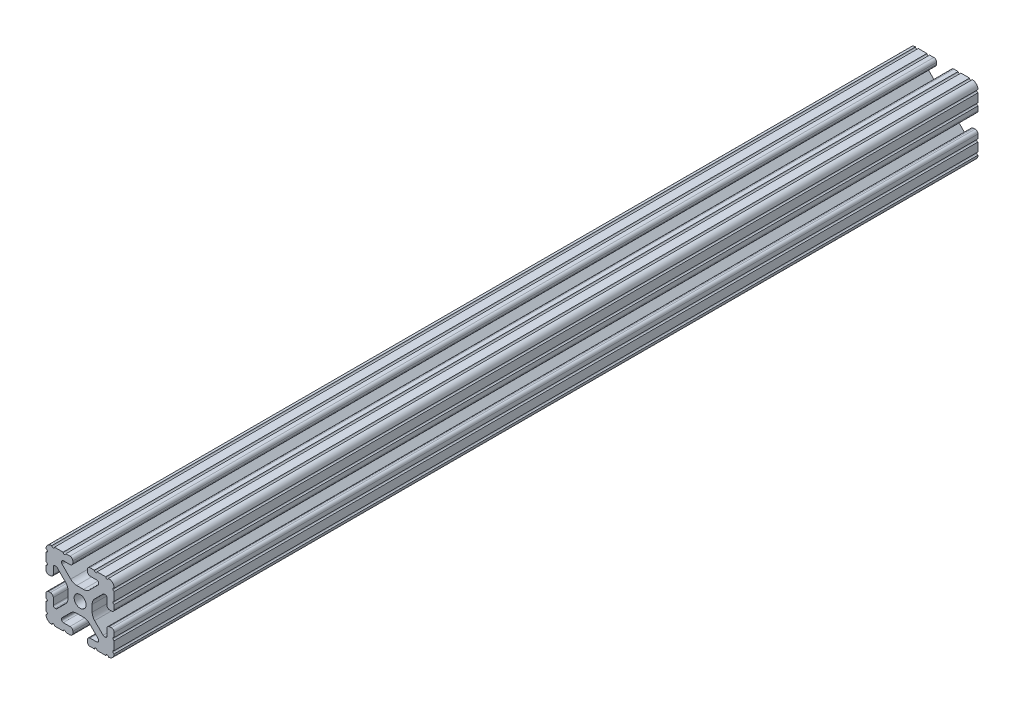
from build123d import *

# Parameters (mm, degrees)
SKETCH1_R           = 3.3274
BOSS_EXTRUDE1_DEPTH = 482.6


with BuildPart() as part:
    # Sketch1 → Boss-Extrude1 (new body)
    with BuildSketch(Plane.XY):
        with BuildLine():
            Line((-14.097, 10.287), (-13.528918, 10.287))
            ThreePointArc((-13.528918, 10.287), (-13.188712428, 10.219328904), (-12.900300071, 10.026617928))
            Line((-12.900300071, 10.026617928), (-8.129198975, 5.255516832))
            ThreePointArc((-8.129198975, 5.255516832), (-7.09957176, 3.71457081), (-6.738014764, 1.896901043))
            Line((-6.738014764, 1.896901043), (-6.738014764, -1.896901043))
            ThreePointArc((-6.738014764, -1.896901043), (-7.09957176, -3.71457081), (-8.129198975, -5.255516832))
            Line((-8.129198975, -5.255516832), (-12.900300071, -10.026617928))
            ThreePointArc((-12.900300071, -10.026617928), (-13.188712428, -10.219328904), (-13.528918, -10.287))
            Line((-13.528918, -10.287), (-14.097, -10.287))
            ThreePointArc((-14.097, -10.287), (-14.725617928, -10.026617928), (-14.986, -9.398))
            Line((-14.986, -9.398), (-14.986, -5.6388))
            ThreePointArc((-14.986, -5.6388), (-15.447248241, -4.525248241), (-16.5608, -4.064))
            Line((-16.5608, -4.064), (-17.4752, -4.064))
            ThreePointArc((-17.4752, -4.064), (-18.588751759, -4.525248241), (-19.05, -5.6388))
            Line((-19.05, -5.6388), (-19.05, -7.9756))
            ThreePointArc((-19.05, -7.9756), (-18.288, -8.7376), (-19.05, -9.4996))
            Line((-19.05, -9.4996), (-19.05, -14.3256))
            ThreePointArc((-19.05, -14.3256), (-18.288, -15.0876), (-19.05, -15.8496))
            Line((-19.05, -15.8496), (-19.05, -15.875))
            ThreePointArc((-19.05, -15.875), (-18.12006403, -18.12006403), (-15.875, -19.05))
            Line((-15.875, -19.05), (-15.8496, -19.05))
            ThreePointArc((-15.8496, -19.05), (-15.0876, -18.288), (-14.3256, -19.05))
            Line((-14.3256, -19.05), (-9.4996, -19.05))
            ThreePointArc((-9.4996, -19.05), (-8.7376, -18.288), (-7.9756, -19.05))
            Line((-7.9756, -19.05), (-5.6388, -19.05))
            ThreePointArc((-5.6388, -19.05), (-4.525248241, -18.588751759), (-4.064, -17.4752))
            Line((-4.064, -17.4752), (-4.064, -16.5608))
            ThreePointArc((-4.064, -16.5608), (-4.525248241, -15.447248241), (-5.6388, -14.986))
            Line((-5.6388, -14.986), (-9.398, -14.986))
            ThreePointArc((-9.398, -14.986), (-10.026617928, -14.725617928), (-10.287, -14.097))
            Line((-10.287, -14.097), (-10.287, -13.528918))
            ThreePointArc((-10.287, -13.528918), (-10.219328904, -13.188712428), (-10.026617928, -12.900300071))
            Line((-10.026617928, -12.900300071), (-5.255516832, -8.129198975))
            ThreePointArc((-5.255516832, -8.129198975), (-3.71457081, -7.09957176), (-1.896901043, -6.738014764))
            Line((-1.896901043, -6.738014764), (1.896901043, -6.738014764))
            ThreePointArc((1.896901043, -6.738014764), (3.71457081, -7.09957176), (5.255516832, -8.129198975))
            Line((5.255516832, -8.129198975), (10.026617928, -12.900300071))
            ThreePointArc((10.026617928, -12.900300071), (10.219328904, -13.188712428), (10.287, -13.528918))
            Line((10.287, -13.528918), (10.287, -14.097))
            ThreePointArc((10.287, -14.097), (10.026617928, -14.725617928), (9.398, -14.986))
            Line((9.398, -14.986), (5.6388, -14.986))
            ThreePointArc((5.6388, -14.986), (4.525248241, -15.447248241), (4.064, -16.5608))
            Line((4.064, -16.5608), (4.064, -17.4752))
            ThreePointArc((4.064, -17.4752), (4.525248241, -18.588751759), (5.6388, -19.05))
            Line((5.6388, -19.05), (7.9756, -19.05))
            ThreePointArc((7.9756, -19.05), (8.7376, -18.288), (9.4996, -19.05))
            Line((9.4996, -19.05), (14.3256, -19.05))
            ThreePointArc((14.3256, -19.05), (15.0876, -18.288), (15.8496, -19.05))
            Line((15.8496, -19.05), (15.875, -19.05))
            ThreePointArc((15.875, -19.05), (18.12006403, -18.12006403), (19.05, -15.875))
            Line((19.05, -15.875), (19.05, -15.8496))
            ThreePointArc((19.05, -15.8496), (18.288, -15.0876), (19.05, -14.3256))
            Line((19.05, -14.3256), (19.05, -9.4996))
            ThreePointArc((19.05, -9.4996), (18.288, -8.7376), (19.05, -7.9756))
            Line((19.05, -7.9756), (19.05, -5.6388))
            ThreePointArc((19.05, -5.6388), (18.588751759, -4.525248241), (17.4752, -4.064))
            Line((17.4752, -4.064), (16.5608, -4.064))
            ThreePointArc((16.5608, -4.064), (15.447248241, -4.525248241), (14.986, -5.6388))
            Line((14.986, -5.6388), (14.986, -9.398))
            ThreePointArc((14.986, -9.398), (14.725617928, -10.026617928), (14.097, -10.287))
            Line((14.097, -10.287), (13.528918, -10.287))
            ThreePointArc((13.528918, -10.287), (13.188712428, -10.219328904), (12.900300071, -10.026617928))
            Line((12.900300071, -10.026617928), (8.129198975, -5.255516832))
            ThreePointArc((8.129198975, -5.255516832), (7.09957176, -3.71457081), (6.738014764, -1.896901043))
            Line((6.738014764, -1.896901043), (6.738014764, 1.896901043))
            ThreePointArc((6.738014764, 1.896901043), (7.09957176, 3.71457081), (8.129198975, 5.255516832))
            Line((8.129198975, 5.255516832), (12.900300071, 10.026617928))
            ThreePointArc((12.900300071, 10.026617928), (13.188712428, 10.219328904), (13.528918, 10.287))
            Line((13.528918, 10.287), (14.097, 10.287))
            ThreePointArc((14.097, 10.287), (14.725617928, 10.026617928), (14.986, 9.398))
            Line((14.986, 9.398), (14.986, 5.6388))
            ThreePointArc((14.986, 5.6388), (15.447248241, 4.525248241), (16.5608, 4.064))
            Line((16.5608, 4.064), (17.4752, 4.064))
            ThreePointArc((17.4752, 4.064), (18.588751759, 4.525248241), (19.05, 5.6388))
            Line((19.05, 5.6388), (19.05, 7.9756))
            ThreePointArc((19.05, 7.9756), (18.288, 8.7376), (19.05, 9.4996))
            Line((19.05, 9.4996), (19.05, 14.3256))
            ThreePointArc((19.05, 14.3256), (18.288, 15.0876), (19.05, 15.8496))
            Line((19.05, 15.8496), (19.05, 15.875))
            ThreePointArc((19.05, 15.875), (18.12006403, 18.12006403), (15.875, 19.05))
            Line((15.875, 19.05), (15.8496, 19.05))
            ThreePointArc((15.8496, 19.05), (15.0876, 18.288), (14.3256, 19.05))
            Line((14.3256, 19.05), (9.4996, 19.05))
            ThreePointArc((9.4996, 19.05), (8.7376, 18.288), (7.9756, 19.05))
            Line((7.9756, 19.05), (5.6388, 19.05))
            ThreePointArc((5.6388, 19.05), (4.525248241, 18.588751759), (4.064, 17.4752))
            Line((4.064, 17.4752), (4.064, 16.5608))
            ThreePointArc((4.064, 16.5608), (4.525248241, 15.447248241), (5.6388, 14.986))
            Line((5.6388, 14.986), (9.398, 14.986))
            ThreePointArc((9.398, 14.986), (10.026617928, 14.725617928), (10.287, 14.097))
            Line((10.287, 14.097), (10.287, 13.528918))
            ThreePointArc((10.287, 13.528918), (10.219328904, 13.188712428), (10.026617928, 12.900300071))
            Line((10.026617928, 12.900300071), (5.255516832, 8.129198975))
            ThreePointArc((5.255516832, 8.129198975), (3.71457081, 7.09957176), (1.896901043, 6.738014764))
            Line((1.896901043, 6.738014764), (-1.896901043, 6.738014764))
            ThreePointArc((-1.896901043, 6.738014764), (-3.71457081, 7.09957176), (-5.255516832, 8.129198975))
            Line((-5.255516832, 8.129198975), (-10.026617928, 12.900300071))
            ThreePointArc((-10.026617928, 12.900300071), (-10.219328904, 13.188712428), (-10.287, 13.528918))
            Line((-10.287, 13.528918), (-10.287, 14.097))
            ThreePointArc((-10.287, 14.097), (-10.026617928, 14.725617928), (-9.398, 14.986))
            Line((-9.398, 14.986), (-5.6388, 14.986))
            ThreePointArc((-5.6388, 14.986), (-4.525248241, 15.447248241), (-4.064, 16.5608))
            Line((-4.064, 16.5608), (-4.064, 17.4752))
            ThreePointArc((-4.064, 17.4752), (-4.525248241, 18.588751759), (-5.6388, 19.05))
            Line((-5.6388, 19.05), (-7.9756, 19.05))
            ThreePointArc((-7.9756, 19.05), (-8.7376, 18.288), (-9.4996, 19.05))
            Line((-9.4996, 19.05), (-14.3256, 19.05))
            ThreePointArc((-14.3256, 19.05), (-15.0876, 18.288), (-15.8496, 19.05))
            Line((-15.8496, 19.05), (-15.875, 19.05))
            ThreePointArc((-15.875, 19.05), (-18.12006403, 18.12006403), (-19.05, 15.875))
            Line((-19.05, 15.875), (-19.05, 15.8496))
            ThreePointArc((-19.05, 15.8496), (-18.288, 15.0876), (-19.05, 14.3256))
            Line((-19.05, 14.3256), (-19.05, 9.4996))
            ThreePointArc((-19.05, 9.4996), (-18.288, 8.7376), (-19.05, 7.9756))
            Line((-19.05, 7.9756), (-19.05, 5.6388))
            ThreePointArc((-19.05, 5.6388), (-18.588751759, 4.525248241), (-17.4752, 4.064))
            Line((-17.4752, 4.064), (-16.5608, 4.064))
            ThreePointArc((-16.5608, 4.064), (-15.447248241, 4.525248241), (-14.986, 5.6388))
            Line((-14.986, 5.6388), (-14.986, 9.398))
            ThreePointArc((-14.986, 9.398), (-14.725617928, 10.026617928), (-14.097, 10.287))
        make_face()
        with Locations(Location((0, 0, 0), (0, 0, 180))):
            Circle(SKETCH1_R, mode=Mode.SUBTRACT)
    extrude(amount=BOSS_EXTRUDE1_DEPTH)


solid = part.part
